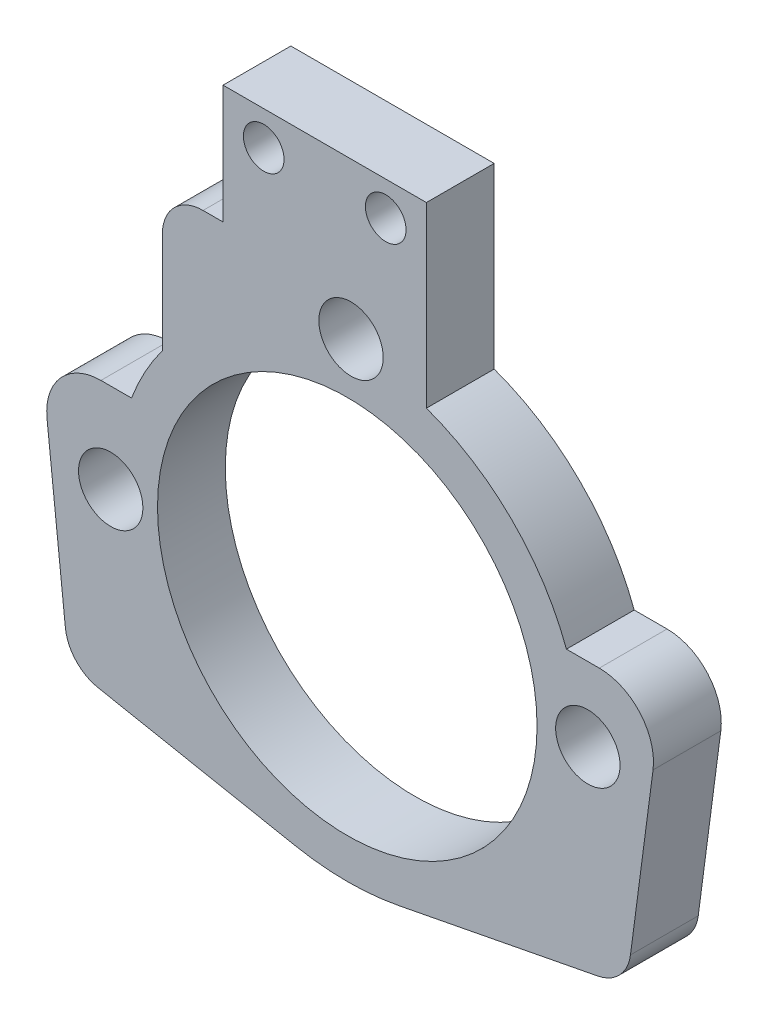
from build123d import *

# Parameters (mm, degrees)
SKETCH4_R           = 2.375
SKETCH4_R_2         = 14
SKETCH4_R_3         = 1.5
BOSS_EXTRUDE1_DEPTH = 5
FILLET1_R           = 4
FILLET2_R           = 3
FILLET3_R           = 20
FILLET4_R           = 3


with BuildPart() as part:
    # Sketch4 → Boss-Extrude1 (new body)
    with BuildSketch(Plane.XY):
        with BuildLine():
            Line((-22.898882881, 5.245209669), (-20.836749357, -14.070107669))
            Line((-20.836749357, -14.070107669), (-0.276312074, -18.058688738))
            Line((-0.276312074, -18.058688738), (20.333519642, -14.070107669))
            Line((20.333519642, -14.070107669), (22.874540819, 5.245209669))
            Line((22.874540819, 5.245209669), (15.890720179, 5.245209669))
            ThreePointArc((15.890720179, 5.245209669), (11.856045842, 11.501579149), (5.56, 15.474054805))
            Line((5.56, 15.474054805), (5.56, 28.613702828))
            Line((5.56, 28.613702828), (0, 28.613702828))
            Line((0, 28.613702828), (-9.44, 28.613702828))
            Line((-9.44, 28.613702828), (-9.44, 19.87109493))
            Line((-9.44, 19.87109493), (-13.915384187, 19.87109493))
            Line((-13.915384187, 19.87109493), (-13.915384187, 9.41227742))
            ThreePointArc((-13.915384187, 9.41227742), (-15.200754202, 7.408655363), (-16.193820238, 5.245209669))
            Line((-16.193820238, 5.245209669), (-22.898882881, 5.245209669))
        make_face()
        with Locations((-17.729765035, -1.352900319)):
            Circle(SKETCH4_R, mode=Mode.SUBTRACT)
        with Locations((0, 17.113702828)):
            Circle(SKETCH4_R, mode=Mode.SUBTRACT)
        with Locations((17.470234965, -0.205387514)):
            Circle(SKETCH4_R, mode=Mode.SUBTRACT)
        with Locations((-0.276312074, -0.751612004)):
            Circle(SKETCH4_R_2, mode=Mode.SUBTRACT)
        with Locations((-6.44, 26.113702828)):
            Circle(SKETCH4_R_3, mode=Mode.SUBTRACT)
        with Locations((2.56, 26.113702828)):
            Circle(SKETCH4_R_3, mode=Mode.SUBTRACT)
    extrude(amount=BOSS_EXTRUDE1_DEPTH)

    # Fillet1
    fillet1_edges = [part.edges().sort_by_distance(p)[0] for p in [
        (-22.898882881, 5.245209669, 2.5),
        (22.874540819, 5.245209669, 2.5),
    ]]
    fillet(fillet1_edges, radius=FILLET1_R)

    # Fillet2
    fillet2_edges = [part.edges().sort_by_distance(p)[0] for p in [
        (-20.836749357, -14.070107669, 2.5),
        (20.333519642, -14.070107669, 2.5),
    ]]
    fillet(fillet2_edges, radius=FILLET2_R)

    # Fillet3
    fillet3_edges = [part.edges().sort_by_distance(p)[0] for p in [
        (-0.276312074, -18.058688738, 2.5),
    ]]
    fillet(fillet3_edges, radius=FILLET3_R)

    # Fillet4
    fillet4_edges = [part.edges().sort_by_distance(p)[0] for p in [
        (-13.915384187, 19.87109493, 2.5),
    ]]
    fillet(fillet4_edges, radius=FILLET4_R)


solid = part.part
